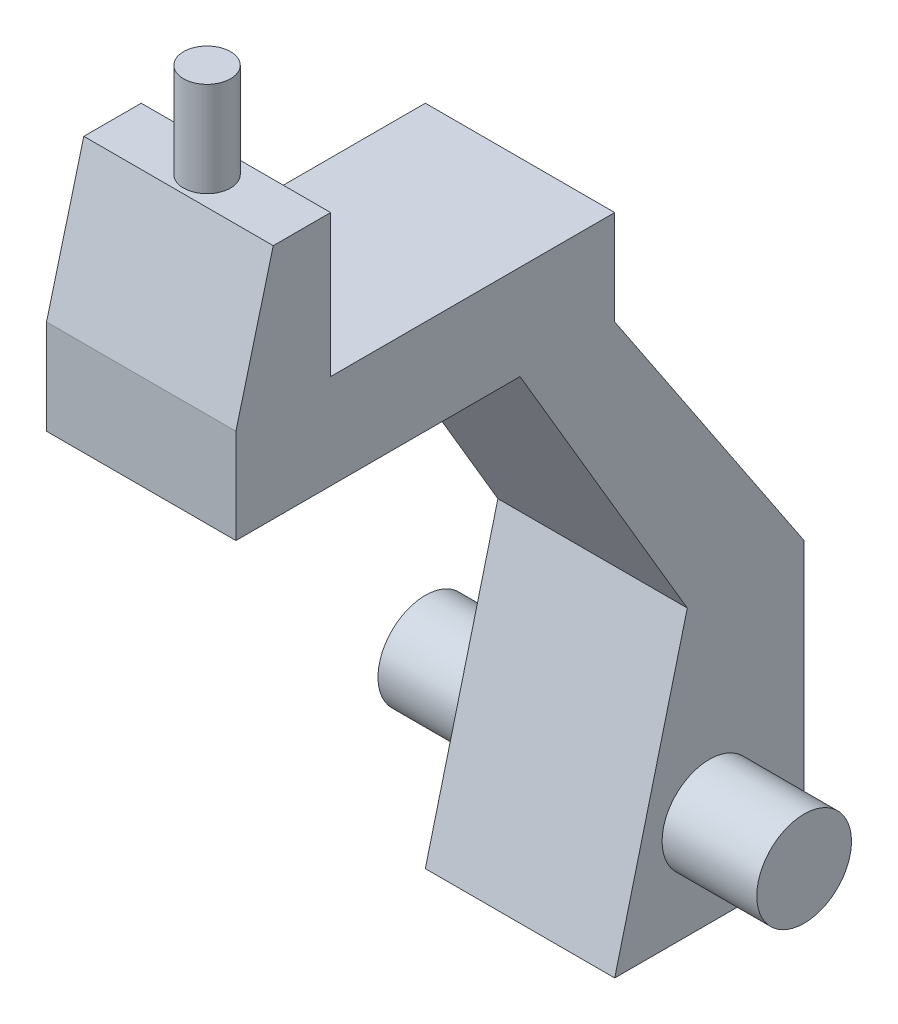
from build123d import *

# Parameters (mm, degrees)
SKETCH1_W           = 20
SKETCH1_H           = 20
BOSS_EXTRUDE2_DEPTH = 30
SKETCH2_R           = 5
BOSS_EXTRUDE3_DEPTH = 10
CUT_EXTRUDE2_DEPTH  = 20
SKETCH5_W           = 20
SKETCH5_H           = 30
BOSS_EXTRUDE4_DEPTH = 30
CUT_EXTRUDE3_DEPTH  = 20
SKETCH7_W           = 20
SKETCH7_H           = 40
BOSS_EXTRUDE5_DEPTH = 10
SKETCH8_W           = 20
SKETCH8_H           = 10
BOSS_EXTRUDE6_DEPTH = 15
CUT_EXTRUDE4_DEPTH  = 20
SKETCH10_R          = 2.481643059
BOSS_EXTRUDE7_DEPTH = 10


with BuildPart() as part:
    # Sketch1 → Boss-Extrude2 (new body)
    with BuildSketch(Plane(origin=(0, 0, 0), x_dir=(1, 0, 0), z_dir=(0, 1, 0))):
        with Locations((1.888111888, -1.538461538)):
            Rectangle(SKETCH1_W, SKETCH1_H)
    extrude(amount=BOSS_EXTRUDE2_DEPTH)

    # Sketch2 → Boss-Extrude3 (add)
    with BuildSketch(Plane(origin=(11.888111888, 0, 0), x_dir=(0, 0, -1), z_dir=(1, 0, 0))):
        with Locations(Location((-1.538461538, 10, 0), (0, 0, 180))):
            Circle(SKETCH2_R)
    boss_extrude3 = extrude(amount=BOSS_EXTRUDE3_DEPTH)

    # Mirror1: Boss-Extrude3 across plane
    add(boss_extrude3.mirror(Plane(origin=(1.888111888, 0, 0), x_dir=(0, 0, 1), z_dir=(1, 0, 0))))

    # Sketch3 → Cut-Extrude2 (cut)
    with BuildSketch(Plane(origin=(11.888111888, 0, 0), x_dir=(0, 0, -1), z_dir=(1, 0, 0))):
        Polygon((-11.538461538, 0), (-3.87574726, 30), (-11.538461538, 30), align=None)
    extrude(amount=-CUT_EXTRUDE2_DEPTH, mode=Mode.SUBTRACT)

    # Sketch5 → Boss-Extrude4 (add)
    with BuildSketch(Plane(origin=(0, 30, 0), x_dir=(1, 0, 0), z_dir=(0, 1, 0))):
        with Locations((1.888111888, -6.538461538)):
            Rectangle(SKETCH5_W, SKETCH5_H)
    extrude(amount=BOSS_EXTRUDE4_DEPTH)

    # Sketch6 → Cut-Extrude3 (cut)
    with BuildSketch(Plane(origin=(11.888111888, 0, 0), x_dir=(0, 0, -1), z_dir=(1, 0, 0))):
        Polygon((-3.87574726, 30), (-21.538461538, 60), (-21.538461538, 30), align=None)
        Polygon((8.461538462, 30), (8.461538462, 60), (-11.538461538, 60), align=None)
    extrude(amount=-CUT_EXTRUDE3_DEPTH, mode=Mode.SUBTRACT)

    # Sketch7 → Boss-Extrude5 (add)
    with BuildSketch(Plane(origin=(0, 60, 0), x_dir=(1, 0, 0), z_dir=(0, 1, 0))):
        with Locations((1.888111888, -31.538461538)):
            Rectangle(SKETCH7_W, SKETCH7_H)
    extrude(amount=BOSS_EXTRUDE5_DEPTH)

    # Sketch8 → Boss-Extrude6 (add)
    with BuildSketch(Plane(origin=(0, 70, 0), x_dir=(1, 0, 0), z_dir=(0, 1, 0))):
        with Locations((1.888111888, -46.538461538)):
            Rectangle(SKETCH8_W, SKETCH8_H)
    extrude(amount=BOSS_EXTRUDE6_DEPTH)

    # Sketch9 → Cut-Extrude4 (cut)
    with BuildSketch(Plane(origin=(11.888111888, 0, 0), x_dir=(0, 0, -1), z_dir=(1, 0, 0))):
        Polygon((-51.538461538, 70), (-47.598538903, 85), (-51.538461538, 85), align=None)
    extrude(amount=-CUT_EXTRUDE4_DEPTH, mode=Mode.SUBTRACT)

    # Sketch10 → Boss-Extrude7 (add)
    with BuildSketch(Plane(origin=(0, 85, 0), x_dir=(1, 0, 0), z_dir=(0, 1, 0))):
        with Locations(Location((1.888111888, -44.588461538, 0), (0, 0, 270))):
            Circle(SKETCH10_R)
    extrude(amount=BOSS_EXTRUDE7_DEPTH)


solid = part.part
